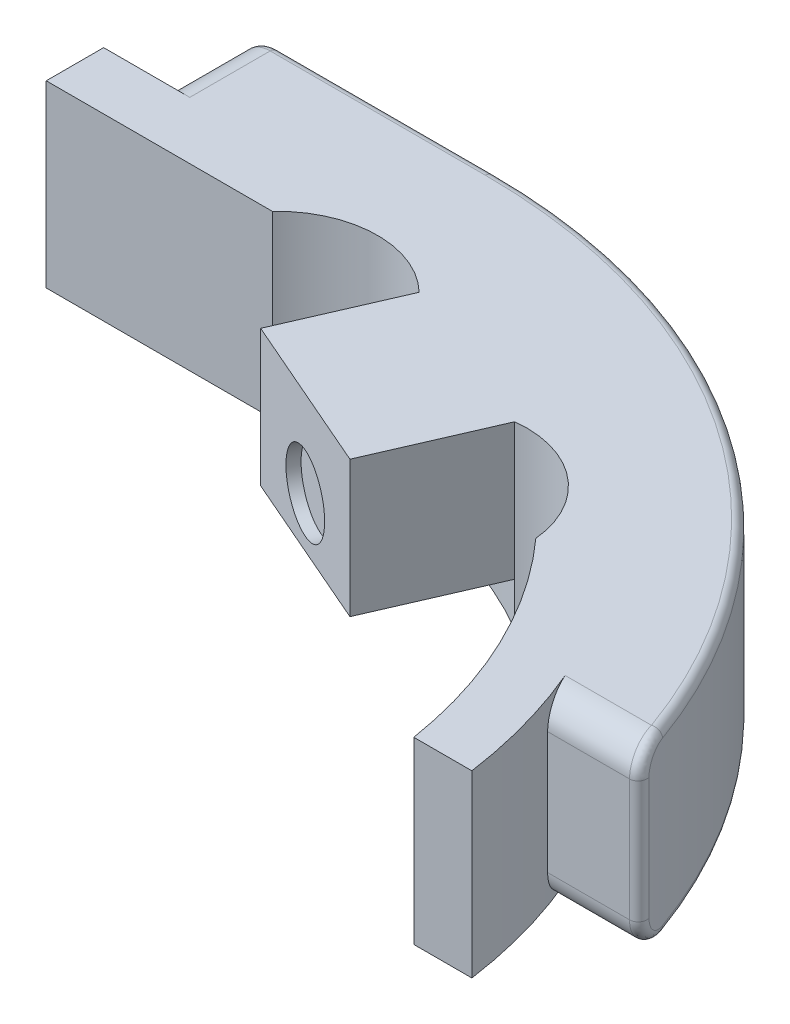
from build123d import *

# Parameters (mm, degrees)
BOSS_EXTRUDE1_DEPTH = 6.25
CUT_EXTRUDE1_DEPTH  = 10
BOSS_EXTRUDE2_DEPTH = 6.25
CUT_EXTRUDE2_START  = -1.5
CUT_EXTRUDE2_DEPTH  = 1.5
MOVE_FACE1_BY       = 0.25
SKETCH5_R           = 1.3
CUT_EXTRUDE3_DEPTH  = 0.4
BOSS_EXTRUDE3_DEPTH = 6.25
MOVE_FACE2_BY       = 0.5
MOVE_FACE2_2_BY     = 0.5
CUT_EXTRUDE4_DEPTH  = 13
CUT_EXTRUDE5_START  = -1.5
CUT_EXTRUDE5_DEPTH  = 1.5
BOSS_EXTRUDE4_DEPTH = 6.25
CUT_EXTRUDE6_DEPTH  = 9.000000000000002
FILLET1_R           = 1
FILLET2_R           = 0.3


with BuildPart() as part:
    # Sketch1 → Boss-Extrude1 (new body)
    with BuildSketch(Plane(origin=(0, 0, 0), x_dir=(1, 0, 0), z_dir=(0, 1, 0))):
        with BuildLine():
            Line((-8.500000000000007, 21.49999999999999), (-8.500000000000007, 15.499999999999982))
            Line((-8.500000000000007, 15.499999999999982), (16.645822822062563, 5.999999999999995))
            Line((16.645822822062563, 5.999999999999995), (20.645822822062566, 5.999999999999995))
            ThreePointArc((20.645822822062566, 5.999999999999995), (12.90833064342558, 17.19374886404939), (0, 21.49999999999999))
            Line((0, 21.49999999999999), (-8.500000000000007, 21.49999999999999))
        make_face()
    extrude(amount=BOSS_EXTRUDE1_DEPTH)

    # Sketch2 → Cut-Extrude1 (cut)
    with BuildSketch(Plane(origin=(0, 6.25, 0), x_dir=(1, 0, 0), z_dir=(0, 1, 0))):
        with BuildLine():
            Line((-9.752670250943163, 2.7674418604651105), (-9.752670250943163, 14.499999999999986))
            Line((-9.752670250943163, 14.499999999999986), (8.3e-16, 14.499999999999986))
            ThreePointArc((8.3e-16, 14.499999999999986), (9.22285457500159, 11.188786953390961), (14.233455854041384, 2.7674418604651105))
            Line((14.233455854041384, 2.7674418604651105), (-9.752670250943163, 2.7674418604651105))
        make_face()
    extrude(amount=-CUT_EXTRUDE1_DEPTH, mode=Mode.SUBTRACT)

    # Sketch3 → Boss-Extrude2 (add)
    with BuildSketch(Plane(origin=(0, 6.25, 0), x_dir=(1, 0, 0), z_dir=(0, 1, 0))):
        Polygon((4.469156931645221, 10.801748174518188), (6.3032770804154685, 10.004250036667695), (8.404211615552752, 14.836068669534448), (2.8125557708062745, 17.02319772649103), (0.8009166341047183, 12.396744450219176), (2.6350367828749666, 11.599246312368683), align=None)
    extrude(amount=-BOSS_EXTRUDE2_DEPTH)

    # Sketch4 → Cut-Extrude2 (cut)
    with BuildSketch(Plane.XZ.offset(CUT_EXTRUDE2_START)):
        with BuildLine():
            Line((12.329816757236909, -7.63057132415126), (4.858273185949837, -3.0066464723283906))
            Line((4.858273185949837, -3.0066464723283906), (-2.1755255087838874, -6.757515163827213))
            Line((-2.1755255087838874, -6.757515163827213), (0.39188162426461154, -14.49470347377149))
            ThreePointArc((0.39188162426461154, -14.49470347377149), (7.227688425031692, -12.570223547362334), (12.329816757236909, -7.63057132415126))
        make_face()
    extrude(amount=CUT_EXTRUDE2_DEPTH, mode=Mode.SUBTRACT)

    # Move Face1: a face moved outward by 0.25
    extrude(part.faces().sort_by_distance((3.552096857, 3.875, -11.200497243))[0], amount=MOVE_FACE1_BY, dir=(-0.398749069, 0, 0.917060074))

    # Sketch5 → Cut-Extrude3 (cut)
    with BuildSketch(Plane(origin=(4.560861605165302, 0, -10.489263571615414), x_dir=(0.917060074385124, 0, 0.3987490689252462), z_dir=(-0.3987490689252462, 0, 0.917060074385124))):
        with Locations((-1.20870163918075, 3.2500000000000084)):
            Circle(SKETCH5_R)
    extrude(amount=-CUT_EXTRUDE3_DEPTH, mode=Mode.SUBTRACT)

    # Sketch6 → Boss-Extrude3 (add)
    with BuildSketch(Plane(origin=(0, 6.25, 0), x_dir=(1, 0, 0), z_dir=(0, 1, 0))):
        Polygon((-8.500000000000007, 15.900685410943252), (-8.398385997633637, 15.900685410943252), (-8.398385997633637, 17.900685410943254), (-8.500000000000007, 17.900685410943254), (-10.500000000000009, 17.900685410943254), (-10.500000000000009, 15.900685410943252), align=None)
    extrude(amount=-BOSS_EXTRUDE3_DEPTH)

    # Move Face2: a face moved inward by 0.5
    extrude(part.faces().sort_by_distance((-4.25, 3.125, -21.5))[0], amount=MOVE_FACE2_BY, dir=(0, 0, 1), mode=Mode.SUBTRACT)

    # Move Face2 2: a curved face moved inward by 0.5
    add(Solid.thicken(part.faces().sort_by_distance((12.908330643, 3.125, -17.193748864))[0], -MOVE_FACE2_2_BY), mode=Mode.SUBTRACT)

    # Sketch7 → Cut-Extrude4 (cut)
    with BuildSketch(Plane(origin=(0, 6.25, 0), x_dir=(1, 0, 0), z_dir=(0, 1, 0))):
        with BuildLine():
            Line((-8.500000000000007, 15.900685410943252), (0, 15.900685410943252))
            ThreePointArc((0, 15.900685410943252), (1.1301672935759872, 15.860470309114884), (2.2546178785171396, 15.740028423089157))
            Line((2.2546178785171396, 15.740028423089157), (1.4365096738849472, 13.858508365832973))
            Line((1.4365096738849472, 13.858508365832973), (0.7012293668734065, 12.167479431622894))
            Line((0.7012293668734065, 12.167479431622894), (6.203589813184157, 9.774985018071414))
            Line((6.203589813184157, 9.774985018071414), (7.238188726101288, 12.15439961732261))
            Line((7.238188726101288, 12.15439961732261), (7.94274956604829, 13.774778614149243))
            ThreePointArc((7.94274956604829, 13.774778614149243), (13.653169200208351, 8.150016400490594), (15.89419526397822, 0.45426143168428607))
            Line((15.89419526397822, 0.45426143168428607), (-20.808588691152597, -0.594716444159659))
            Line((-20.808588691152597, -0.594716444159659), (-15.374732718008488, 14.86339738490728))
            Line((-15.374732718008488, 14.86339738490728), (-8.500000000000007, 15.900685410943252))
        make_face()
    extrude(amount=-CUT_EXTRUDE4_DEPTH, mode=Mode.SUBTRACT)

    # Sketch8 → Cut-Extrude5 (cut)
    with BuildSketch(Plane.XZ.offset(CUT_EXTRUDE5_START)):
        with BuildLine():
            Line((14.339308110473954, -6.871392831928589), (1.9043764034639075, -3.0604478341676384))
            Line((1.9043764034639075, -3.0604478341676384), (-4.2629376925202305, -10.324173324993405))
            Line((-4.2629376925202305, -10.324173324993405), (0.7554626751993575, -15.882728754347104))
            ThreePointArc((0.7554626751993575, -15.882728754347104), (8.789998296056245, -13.250197224687337), (14.339308110473954, -6.871392831928589))
        make_face()
    extrude(amount=CUT_EXTRUDE5_DEPTH, mode=Mode.SUBTRACT)

    # Sketch9 → Boss-Extrude4 (add)
    with BuildSketch(Plane(origin=(0, 6.25, 0), x_dir=(1, 0, 0), z_dir=(0, 1, 0))):
        with BuildLine():
            Line((15.70292318448331, 2.500000000000002), (17.725251454235494, 2.500000000000002))
            ThreePointArc((17.725251454235494, 2.500000000000002), (16.78932753436898, 6.209107831207082), (15.086677514257817, 9.634661420966763))
            Line((15.086677514257817, 9.634661420966763), (13.225064123719731, 8.827767297640147))
            ThreePointArc((13.225064123719731, 8.827767297640147), (14.805987713393527, 5.797803408931993), (15.70292318448331, 2.500000000000002))
        make_face()
    extrude(amount=-BOSS_EXTRUDE4_DEPTH)

    # Sketch11 → Cut-Extrude6 (cut)
    with BuildSketch(Plane(origin=(0, 6.25, 0), x_dir=(1, 0, 0), z_dir=(0, 1, 0))):
        with BuildLine():
            Line((7.94274956604829, 13.774778614149243), (11.827692426009557, 10.627205108282226))
            ThreePointArc((11.827692426009557, 10.627205108282226), (10.546532646680365, 13.017226325833846), (7.94274956604829, 13.774778614149243))
        make_face()
        with BuildLine():
            Line((0.7012293668734065, 12.167479431622894), (2.2546178785171413, 15.740028423089157))
            Line((2.2546178785171413, 15.740028423089157), (2.374242599194715, 16.015146445404692))
            ThreePointArc((2.374242599194715, 16.015146445404692), (-0.14915074669056683, 17.00815088772086), (-2.6244470962744906, 15.900685410943252))
            Line((-2.6244470962744906, 15.900685410943252), (0.7012293668734065, 12.167479431622894))
        make_face()
    extrude(amount=-CUT_EXTRUDE6_DEPTH, mode=Mode.SUBTRACT)

    # Fillet1
    fillet1_edges = [part.edges().sort_by_distance(p)[0] for p in [
        (-8.500000000000007, 6.25, -19.45034270547162),
        (18.49489949615255, 0, -5.999999999999995),
        (18.49489949615255, 6.25, -5.999999999999995),
        (-8.500000000000007, 0, -19.45034270547162),
    ]]
    fillet(fillet1_edges, radius=FILLET1_R)

    # Fillet2
    fillet2_edges = [part.edges().sort_by_distance(p)[0] for p in [
        (12.124355652982135, 6.25, -17.146428199482237),
        (-8.500000000000007, 3.1249999999999996, -20.99999999999999),
        (-8.207106781186555, 0.2928932188134522, -20.99999999999999),
        (-8.207106781186555, 5.957106781186548, -20.99999999999999),
        (12.124355652982135, 0, -17.146428199482237),
        (20.124611797498098, 3.125, -5.999999999999995),
        (20.031843616518877, 5.96687308089546, -6.302796311029798),
        (20.03184361651888, 0.2831269191045398, -6.302796311029798),
        (-3.7500000000000036, 0, -20.99999999999999),
        (-3.7500000000000036, 6.25, -20.99999999999999),
    ]]
    fillet(fillet2_edges, radius=FILLET2_R)


solid = part.part
